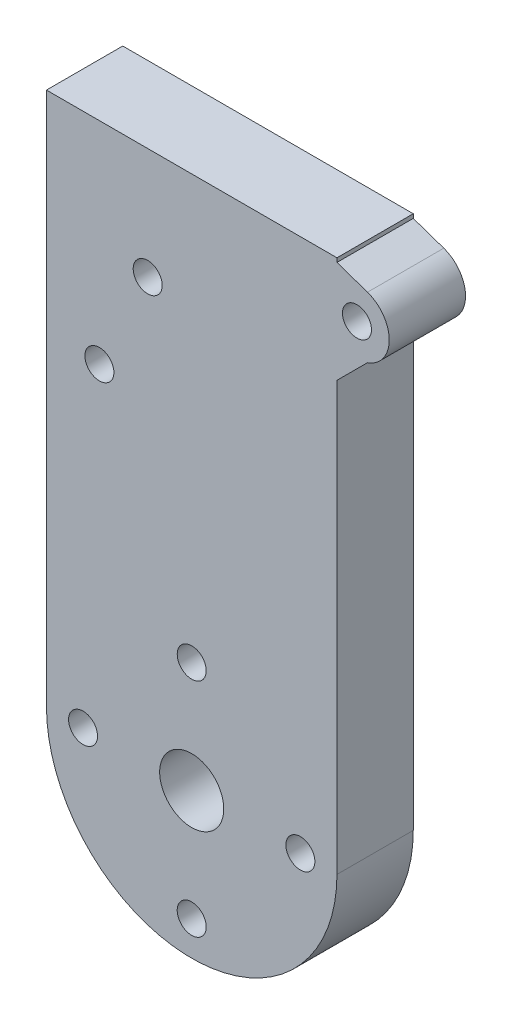
from build123d import *

# Parameters (mm, degrees)
SKETCH1_R           = 1.9
SKETCH1_R_2         = 4.2
BOSS_EXTRUDE1_DEPTH = 10
SKETCH2_R           = 12
BOSS_EXTRUDE2_DEPTH = 7
SKETCH3_R           = 11.2
CUT_EXTRUDE1_DEPTH  = 7
SKETCH4_R           = 2.9
CUT_EXTRUDE2_DEPTH  = 2


with BuildPart() as part:
    # Sketch1 → Boss-Extrude1 (new body)
    with BuildSketch(Plane(origin=(0, 0, 0), x_dir=(0, 1, 0), z_dir=(0, 0, 1))):
        with BuildLine():
            Line((0, 19.038851754), (70, 19.038851754))
            Line((70, 19.038851754), (70, -19.038851754))
            Line((70, -19.038851754), (69.469297143, -19.038851754))
            Line((69.469297143, -19.038851754), (68.091336606, -23.038851754))
            ThreePointArc((68.091336606, -23.038851754), (64.091336606, -25.891585633), (60.091336606, -23.038851754))
            Line((60.091336606, -23.038851754), (56.091336606, -19.038851754))
            Line((56.091336606, -19.038851754), (0, -19.038851754))
            ThreePointArc((0, -19.038851754), (-19.038851754, 0), (0, 19.038851754))
        make_face()
        with Locations(Location((0, 14.242669761, 0), (0, 0, 270))):
            Circle(SKETCH1_R, mode=Mode.SUBTRACT)
        with Locations(Location((0, 0, 0), (0, 0, 270))):
            Circle(SKETCH1_R_2, mode=Mode.SUBTRACT)
        with Locations(Location((0, -14.242669761, 0), (0, 0, 90))):
            Circle(SKETCH1_R, mode=Mode.SUBTRACT)
        with Locations(Location((-14.537854627, 0, 0), (0, 0, 270))):
            Circle(SKETCH1_R, mode=Mode.SUBTRACT)
        with Locations(Location((14.537854627, 0, 0), (0, 0, 90))):
            Circle(SKETCH1_R, mode=Mode.SUBTRACT)
        with Locations(Location((64.091336606, -21.660891217, 0), (0, 0, 270))):
            Circle(SKETCH1_R, mode=Mode.SUBTRACT)
        with Locations(Location((42.352384866, 12.099919194, 0), (0, 0, 270))):
            Circle(SKETCH1_R, mode=Mode.SUBTRACT)
        with Locations(Location((55.398759947, 5.77203667, 0), (0, 0, 270))):
            Circle(SKETCH1_R, mode=Mode.SUBTRACT)
    extrude(amount=BOSS_EXTRUDE1_DEPTH)

    # Sketch2 → Boss-Extrude2 (add)
    with BuildSketch(Plane(origin=(0, 0, 0), x_dir=(1, 0, 0), z_dir=(0, 0, -1))):
        Circle(SKETCH2_R)
    extrude(amount=BOSS_EXTRUDE2_DEPTH)

    # Sketch3 → Cut-Extrude1 (cut)
    with BuildSketch(Plane(origin=(0, 0, -7), x_dir=(1, 0, 0), z_dir=(0, 0, -1))):
        with Locations(Location((0, 0, 0), (0, 0, 180))):
            Circle(SKETCH3_R)
    extrude(amount=-CUT_EXTRUDE1_DEPTH, mode=Mode.SUBTRACT)

    # Sketch4 → Cut-Extrude2 (cut)
    with BuildSketch(Plane(origin=(0, 0, 0), x_dir=(1, 0, 0), z_dir=(0, 0, -1))):
        with Locations(Location((-12.099919194, -42.352384866, 0), (0, 0, 180))):
            Circle(SKETCH4_R)
        with Locations(Location((-5.77203667, -55.398759947, 0), (0, 0, 180))):
            Circle(SKETCH4_R)
    extrude(amount=-CUT_EXTRUDE2_DEPTH, mode=Mode.SUBTRACT)


solid = part.part
